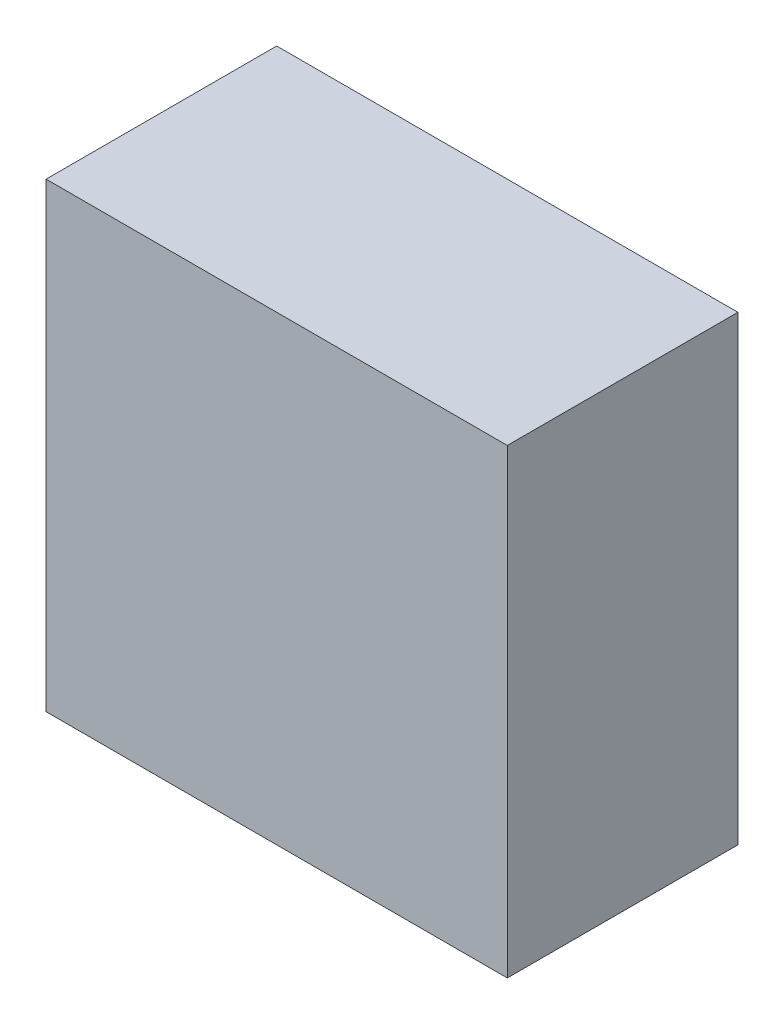
from build123d import *

# Parameters (mm, degrees)
BOSS_EXTRUDE1_DEPTH      = 10
BOSS_EXTRUDE1_DEPTH_BACK = 10
SKETCH1_W                = 40
SKETCH1_H                = 40
SKETCH2_W                = 10
SKETCH2_H                = 10
CUT_EXTRUDE1_DEPTH       = 5


with BuildPart() as part:
    # Sketch1 → Boss-Extrude1 (new, two sides: drawn at the far end of the back side and taken through both)
    with BuildSketch(Plane.XY.offset(-BOSS_EXTRUDE1_DEPTH_BACK)):
        with Locations((20, 20)):
            Rectangle(SKETCH1_W, SKETCH1_H)
    extrude(amount=BOSS_EXTRUDE1_DEPTH + BOSS_EXTRUDE1_DEPTH_BACK)

    # Sketch2 → Cut-Extrude1 (cut)
    with BuildSketch(Plane.XY):
        with Locations((5, 5)):
            Rectangle(SKETCH2_W, SKETCH2_H)
    extrude(amount=CUT_EXTRUDE1_DEPTH, mode=Mode.SUBTRACT)


solid = part.part
